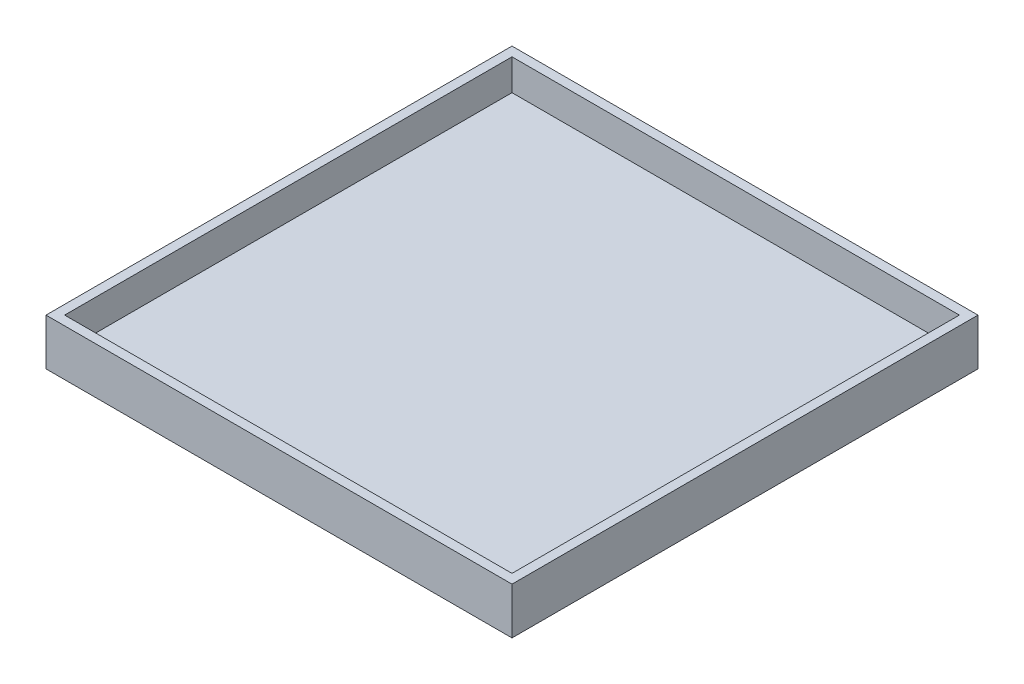
from build123d import *

# Parameters (mm, degrees)
SKETCH1_W           = 150
SKETCH1_H           = 150
BOSS_EXTRUDE1_DEPTH = 15
SKETCH3_W           = 144
SKETCH3_H           = 144
CUT_EXTRUDE1_DEPTH  = 10


with BuildPart() as part:
    # Sketch1 → Boss-Extrude1 (new body)
    with BuildSketch(Plane(origin=(0, 0, 0), x_dir=(1, 0, 0), z_dir=(0, 1, 0))):
        Rectangle(SKETCH1_W, SKETCH1_H)
    extrude(amount=BOSS_EXTRUDE1_DEPTH)

    # Sketch3 → Cut-Extrude1 (cut)
    with BuildSketch(Plane(origin=(0, 15, 0), x_dir=(1, 0, 0), z_dir=(0, 1, 0))):
        Rectangle(SKETCH3_W, SKETCH3_H)
    extrude(amount=-CUT_EXTRUDE1_DEPTH, mode=Mode.SUBTRACT)


solid = part.part
